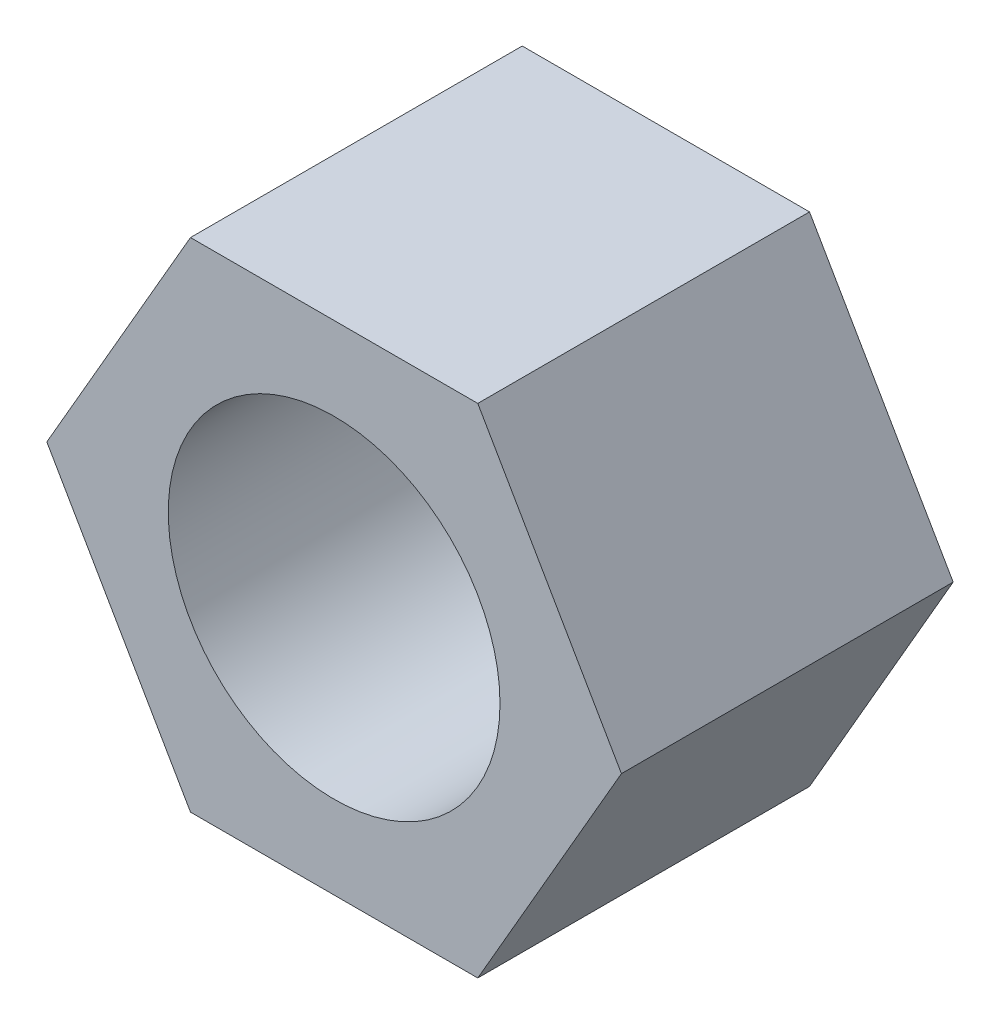
from build123d import *

# Parameters (mm, degrees)
SKETCH_1_R      = 1
EXTRUDE_1_DEPTH = 2


with BuildPart() as part:
    # 草图1 → 凸台-拉伸1 (new body)
    with BuildSketch(Plane.XY):
        Polygon((1.732050808, 0), (0.866025404, 1.5), (-0.866025404, 1.5), (-1.732050808, 0), (-0.866025404, -1.5), (0.866025404, -1.5), align=None)
        Circle(SKETCH_1_R, mode=Mode.SUBTRACT)
    extrude(amount=EXTRUDE_1_DEPTH)


solid = part.part
